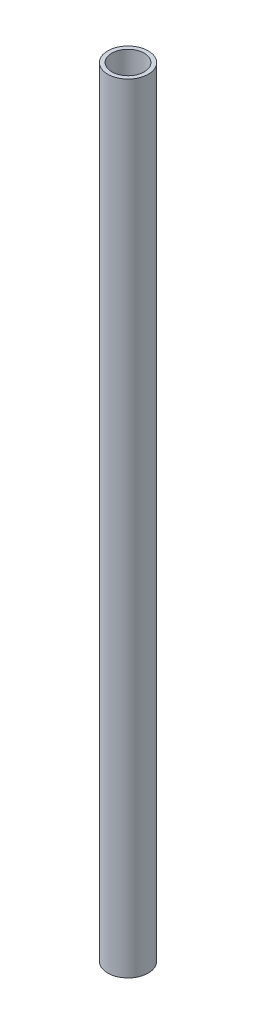
from build123d import *

# Parameters (mm, degrees)
SKETCH1_R             = 15.875
SKETCH1_R_2           = 12.7
SHAFT_EXTRUSION_DEPTH = 609.6


with BuildPart() as part:
    # Sketch1 → Shaft extrusion (new body)
    with BuildSketch(Plane(origin=(0, 0, 0), x_dir=(1, 0, 0), z_dir=(0, 1, 0))):
        with Locations(Location((0, 0, 0), (0, 0, 90))):
            Circle(SKETCH1_R)
        with Locations(Location((0, 0, 0), (0, 0, 90))):
            Circle(SKETCH1_R_2, mode=Mode.SUBTRACT)
    extrude(amount=SHAFT_EXTRUSION_DEPTH)


solid = part.part
